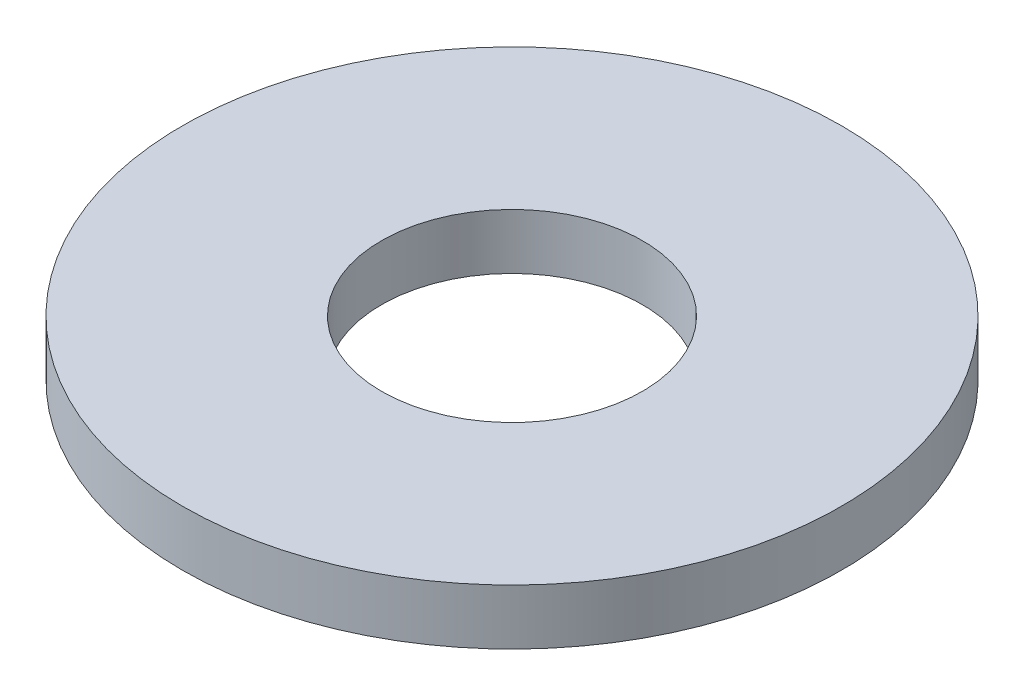
from build123d import *

# Parameters (mm, degrees)
SKETCH_1_R      = 5.05
SKETCH_1_R_2    = 2
EXTRUDE_1_DEPTH = 0.85


with BuildPart() as part:
    # ｽｹｯﾁ1 → 押し出し1 (new body)
    with BuildSketch(Plane(origin=(0, 0, 0), x_dir=(1, 0, 0), z_dir=(0, 1, 0))):
        with Locations(Location((0, 0, 0), (0, 0, 270))):
            Circle(SKETCH_1_R)
        with Locations(Location((0, 0, 0), (0, 0, 270))):
            Circle(SKETCH_1_R_2, mode=Mode.SUBTRACT)
    extrude(amount=EXTRUDE_1_DEPTH)


solid = part.part
